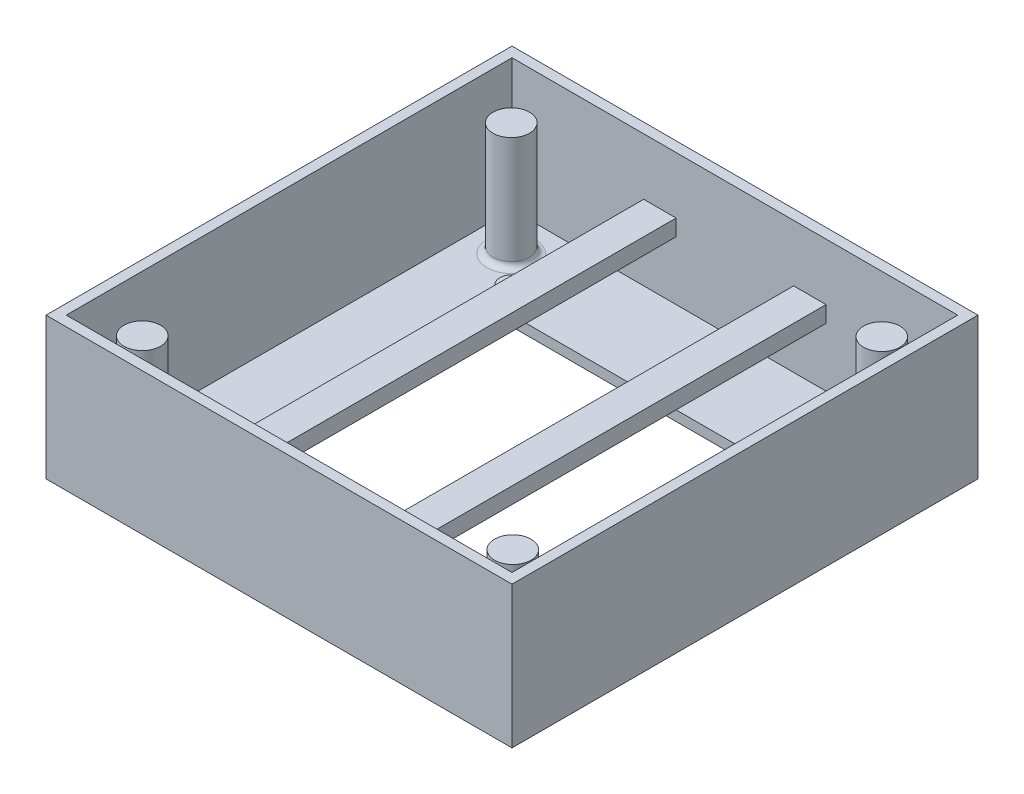
from build123d import *

# Parameters (mm, degrees)
SKETCH2_W           = 115
SKETCH2_H           = 115
BOSS_EXTRUDE1_DEPTH = 35
SHELL1_T            = -2.5
SKETCH3_R           = 4.5
BOSS_EXTRUDE4_DEPTH = 28
FILLET1_R           = 1.5
FILLET2_R           = 1.5
FILLET3_R           = 1.5
FILLET4_R           = 1.5
SKETCH4_W           = 65
SKETCH4_H           = 65
CUT_EXTRUDE1_DEPTH  = 89.529656048
SKETCH5_W           = 8
SKETCH5_H           = 112
BOSS_EXTRUDE5_DEPTH = 4
SKETCH7_R           = 0.85
CUT_EXTRUDE10_DEPTH = 3
SKETCH15_R          = 3
BOSS_EXTRUDE6_DEPTH = 4


with BuildPart() as part:
    # Sketch2 → Boss-Extrude1 (new body)
    with BuildSketch(Plane(origin=(0, 0, 0), x_dir=(1, 0, 0), z_dir=(0, 1, 0))):
        Rectangle(SKETCH2_W, SKETCH2_H)
    extrude(amount=BOSS_EXTRUDE1_DEPTH)

    # Shell1
    shell1_openings = [part.faces().sort_by_distance(p)[0] for p in [
        (0, 35, 0),
    ]]
    offset(amount=SHELL1_T, openings=shell1_openings, kind=Kind.INTERSECTION)

    # Sketch3 → Boss-Extrude4 (add)
    with BuildSketch(Plane(origin=(0, 2.5, 0), x_dir=(1, 0, 0), z_dir=(0, 1, 0))):
        with Locations(Location((-45.72, -45.53, 0), (0, 0, 270))):
            Circle(SKETCH3_R)
        with Locations(Location((-45.72, 45.53, 0), (0, 0, 270))):
            Circle(SKETCH3_R)
        with Locations(Location((45.72, 45.53, 0), (0, 0, 270))):
            Circle(SKETCH3_R)
        with Locations(Location((45.72, -45.53, 0), (0, 0, 270))):
            Circle(SKETCH3_R)
    extrude(amount=BOSS_EXTRUDE4_DEPTH)

    # Fillet1
    fillet1_edges = [part.edges().sort_by_distance(p)[0] for p in [
        (-45.72, 2.5, 41.03),
    ]]
    fillet(fillet1_edges, radius=FILLET1_R)

    # Fillet2
    fillet2_edges = [part.edges().sort_by_distance(p)[0] for p in [
        (-45.72, 2.5, -50.03),
    ]]
    fillet(fillet2_edges, radius=FILLET2_R)

    # Fillet3
    fillet3_edges = [part.edges().sort_by_distance(p)[0] for p in [
        (45.72, 2.5, -50.03),
    ]]
    fillet(fillet3_edges, radius=FILLET3_R)

    # Fillet4
    fillet4_edges = [part.edges().sort_by_distance(p)[0] for p in [
        (45.72, 2.5, 41.03),
    ]]
    fillet(fillet4_edges, radius=FILLET4_R)

    # Sketch4 → Cut-Extrude1 (cut, through all)
    with BuildSketch(Plane.XZ):
        Rectangle(SKETCH4_W, SKETCH4_H)
    extrude(amount=-CUT_EXTRUDE1_DEPTH, mode=Mode.SUBTRACT)

    # Sketch5 → Boss-Extrude5 (add)
    with BuildSketch(Plane(origin=(0, 17, 0), x_dir=(1, 0, 0), z_dir=(0, 1, 0))):
        with Locations((-18.5, 0)):
            Rectangle(SKETCH5_W, SKETCH5_H)
        with Locations((18.5, -0.001)):
            Rectangle(SKETCH5_W, SKETCH5_H)
    extrude(amount=BOSS_EXTRUDE5_DEPTH)

    # Sketch7 → Cut-Extrude10 (cut)
    with BuildSketch(Plane.XZ.offset(-17)):
        with Locations(Location((-18.5, 0, 0), (0, 0, 270))):
            Circle(SKETCH7_R)
        with Locations(Location((18.5, 0, 0), (0, 0, 270))):
            Circle(SKETCH7_R)
    extrude(amount=-CUT_EXTRUDE10_DEPTH, mode=Mode.SUBTRACT)

    # Sketch15 → Boss-Extrude6 (add)
    with BuildSketch(Plane.XZ):
        with Locations(Location((37.5, -37.5, 0), (0, 0, 270))):
            Circle(SKETCH15_R)
        with Locations(Location((-37.5, -37.5, 0), (0, 0, 270))):
            Circle(SKETCH15_R)
        with Locations(Location((-37.5, 37.5, 0), (0, 0, 270))):
            Circle(SKETCH15_R)
        with Locations(Location((37.5, 37.5, 0), (0, 0, 270))):
            Circle(SKETCH15_R)
    extrude(amount=-BOSS_EXTRUDE6_DEPTH)


solid = part.part
